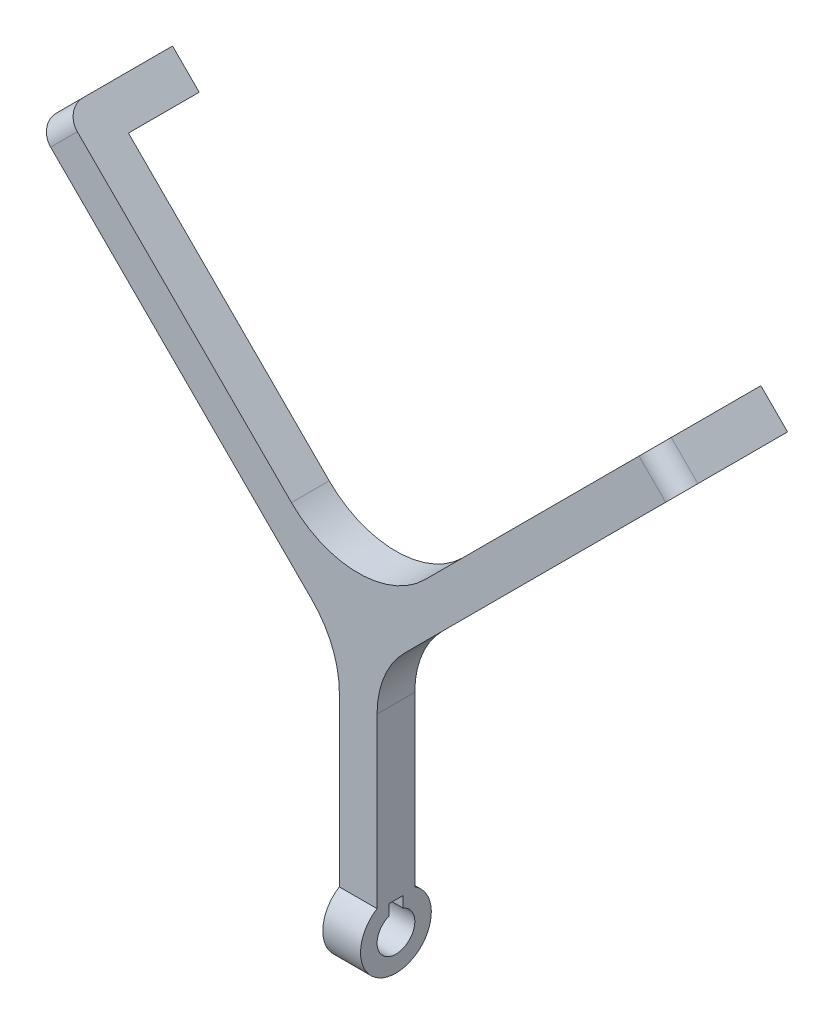
from build123d import *

# Parameters (mm, degrees)
BOSS_EXTRU_1_DEPTH      = 8
BOSS_EXTRU_2_DEPTH      = 15
CONG_1_R                = 20
CONG_2_R                = 4
ESQUISSE3_R             = 7.5
BOSS_EXTRU_3_DEPTH      = 8
ENL_V_MAT_EXTRU_1_DEPTH = 141.744449269


with BuildPart() as part:
    # Esquisse1 → Boss.-Extru.1 (new body)
    with BuildSketch(Plane.XY):
        Polygon((64, 0), (64, 50.343145751), (0, 114.343145751), (5.656854249, 120), (68, 57.656854249), (130.343145751, 120), (136, 114.343145751), (72, 50.343145751), (72, 0), align=None)
    extrude(amount=BOSS_EXTRU_1_DEPTH)

    # Esquisse2 → Boss.-Extru.2 (add)
    with BuildSketch(Plane(origin=(0, 0, 0), x_dir=(-1, 0, 0), z_dir=(0, 0, -1))):
        Polygon((-130.343145751, 108.686291501), (-136, 114.343145751), (-130.343145751, 120), (-124.686291501, 114.343145751), align=None)
        Polygon((0, 114.343145751), (-5.656854249, 108.686291501), (-11.313708499, 114.343145751), (-5.656854249, 120), align=None)
    extrude(amount=BOSS_EXTRU_2_DEPTH)

    # Congé1
    cong_1_edges = [part.edges().sort_by_distance(p)[0] for p in [
        (64, 50.343145751, 4),
        (68, 57.656854249, 4),
        (72, 50.343145751, 4),
    ]]
    fillet(cong_1_edges, radius=CONG_1_R)

    # Congé2
    cong_2_edges = [part.edges().sort_by_distance(p)[0] for p in [
        (133.171572875, 117.171572875, 8),
        (2.828427125, 117.171572875, 8),
    ]]
    fillet(cong_2_edges, radius=CONG_2_R)

    # Esquisse3 → Boss.-Extru.3 (add)
    with BuildSketch(Plane.ZY.offset(-64)):
        with Locations((4, 0)):
            Circle(ESQUISSE3_R)
    extrude(amount=-BOSS_EXTRU_3_DEPTH)

    # Esquisse4 → Enlèv. mat.-Extru.1 (cut, through all)
    with BuildSketch(Plane.ZY.offset(-64)):
        with BuildLine():
            Line((2.5, 3.708099244), (2.5, 6))
            Line((2.5, 6), (5.5, 6))
            Line((5.5, 6), (5.5, 3.708099244))
            ThreePointArc((5.5, 3.708099244), (4, -4), (2.5, 3.708099244))
        make_face()
    extrude(amount=-ENL_V_MAT_EXTRU_1_DEPTH, mode=Mode.SUBTRACT)


solid = part.part
